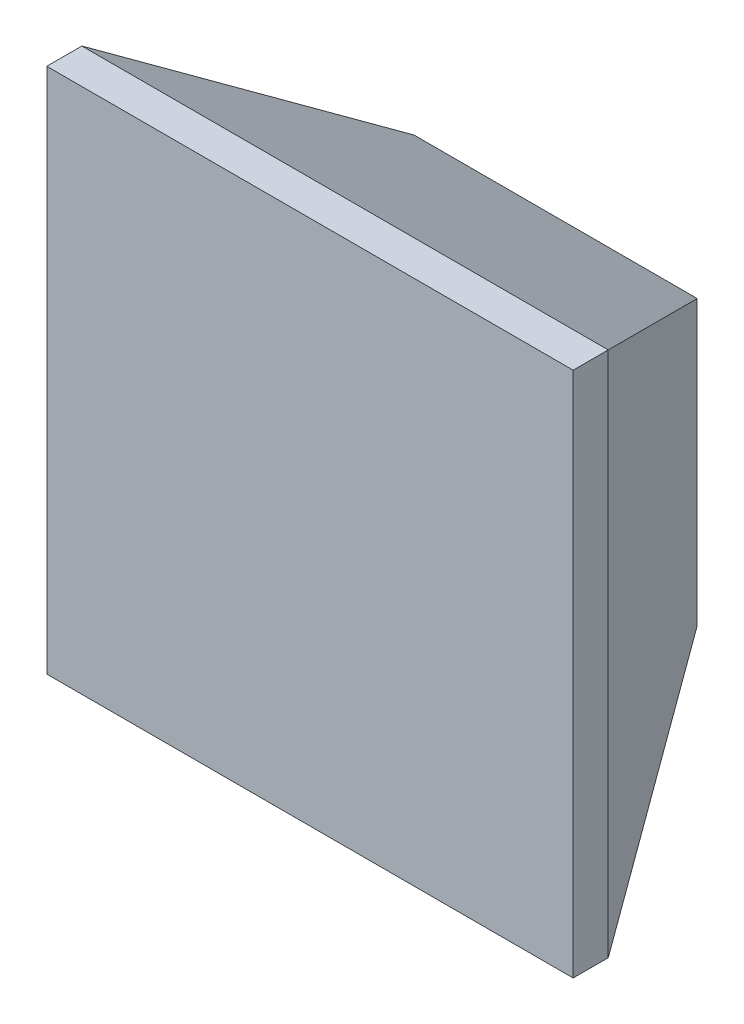
from build123d import *

# Parameters (mm, degrees)
EXTRUDE1_START           = -10
SKETCH1_W                = 150
SKETCH1_H                = 150
EXTRUDE1_DEPTH           = 10
EXTRUDE1_OTHER_WAY_DEPTH = 60
EXTRUDE1_OTHER_WAY_TAPER = 30


with BuildPart() as part:
    # Sketch1 → Extrude1 (new body)
    with BuildSketch(Plane.XY.offset(EXTRUDE1_START)):
        Rectangle(SKETCH1_W, SKETCH1_H)
    extrude(amount=EXTRUDE1_DEPTH)

    # Sketch1 → Extrude1 other way (add)
    with BuildSketch(Plane.XY.offset(EXTRUDE1_START)):
        Rectangle(SKETCH1_W, SKETCH1_H)
    extrude(amount=-EXTRUDE1_OTHER_WAY_DEPTH, taper=EXTRUDE1_OTHER_WAY_TAPER)


solid = part.part
